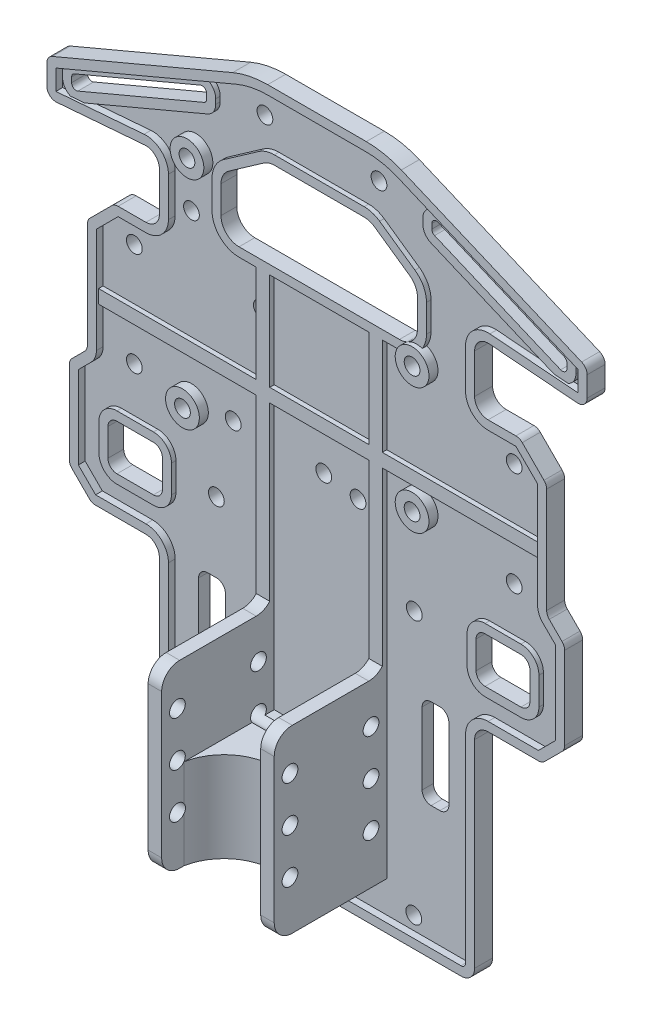
from build123d import *

# Parameters (mm, degrees)
BOSS_EXTRUDE1_DEPTH     = 2.5
CUT_EXTRUDE6_DEPTH      = 101.031245119
CUT_EXTRUDE8_DEPTH      = 101.031245119
CUT_EXTRUDE8_DEPTH_BACK = 101.031245119
SKETCH17_R              = 1.75
BOSS_EXTRUDE2_DEPTH     = 1.5
SKETCH20_R              = 1.75
CUT_EXTRUDE9_DEPTH      = 101.031245119
BOSS_EXTRUDE3_DEPTH     = 25
CUT_EXTRUDE10_DEPTH     = 33
SKETCH23_R              = 1.75
CUT_EXTRUDE11_DEPTH     = 113.393282717
LPATTERN1_COUNT         = 3
LPATTERN1_PITCH         = 10
FILLET1_R               = 4
BOSS_EXTRUDE4_START     = 1
BOSS_EXTRUDE4_DEPTH     = 1
BOSS_EXTRUDE5_START     = 2
SKETCH25_R              = 3.75
SKETCH25_R_2            = 1.75
BOSS_EXTRUDE5_DEPTH     = 2
BOSS_EXTRUDE6_DEPTH     = 1


with BuildPart() as part:
    # Sketch1 → Boss-Extrude1 (new body)
    with BuildSketch(Plane.XY):
        with BuildLine():
            Line((-35, 41.750415311), (-35, 33))
            ThreePointArc((-35, 33), (-35.878679656, 30.878679656), (-38, 30))
            Line((-38, 30), (-44.171572875, 30))
            ThreePointArc((-44.171572875, 30), (-44.93693974, 29.847759065), (-45.585786438, 29.414213562))
            Line((-45.585786438, 29.414213562), (-50.414213562, 24.585786438))
            ThreePointArc((-50.414213562, 24.585786438), (-50.847759065, 23.93693974), (-51, 23.171572875))
            Line((-51, 23.171572875), (-51, -0.171572875))
            ThreePointArc((-51, -0.171572875), (-51.152240935, -0.93693974), (-51.585786438, -1.585786438))
            Line((-51.585786438, -1.585786438), (-54.414213562, -4.414213562))
            ThreePointArc((-54.414213562, -4.414213562), (-54.847759065, -5.06306026), (-55, -5.828427125))
            Line((-55, -5.828427125), (-55, -24.171572875))
            ThreePointArc((-55, -24.171572875), (-54.847759065, -24.93693974), (-54.414213562, -25.585786438))
            Line((-54.414213562, -25.585786438), (-50.585786438, -29.414213562))
            ThreePointArc((-50.585786438, -29.414213562), (-49.93693974, -29.847759065), (-49.171572875, -30))
            Line((-49.171572875, -30), (-38, -30))
            ThreePointArc((-38, -30), (-35.878679656, -30.878679656), (-35, -33))
            Line((-35, -33), (-35, -77))
            ThreePointArc((-35, -77), (-34.121320344, -79.121320344), (-32, -80))
            Line((-32, -80), (32, -80))
            ThreePointArc((32, -80), (34.121320344, -79.121320344), (35, -77))
            Line((35, -77), (35, -33))
            ThreePointArc((35, -33), (35.878679656, -30.878679656), (38, -30))
            Line((38, -30), (49.171572875, -30))
            ThreePointArc((49.171572875, -30), (49.93693974, -29.847759065), (50.585786438, -29.414213562))
            Line((50.585786438, -29.414213562), (54.414213562, -25.585786438))
            ThreePointArc((54.414213562, -25.585786438), (54.847759065, -24.93693974), (55, -24.171572875))
            Line((55, -24.171572875), (55, -5.828427125))
            ThreePointArc((55, -5.828427125), (54.847759065, -5.06306026), (54.414213562, -4.414213562))
            Line((54.414213562, -4.414213562), (51.585786438, -1.585786438))
            ThreePointArc((51.585786438, -1.585786438), (51.152240935, -0.93693974), (51, -0.171572875))
            Line((51, -0.171572875), (51, 23.171572875))
            ThreePointArc((51, 23.171572875), (50.847759065, 23.93693974), (50.414213562, 24.585786438))
            Line((50.414213562, 24.585786438), (45.585786438, 29.414213562))
            ThreePointArc((45.585786438, 29.414213562), (44.93693974, 29.847759065), (44.171572875, 30))
            Line((44.171572875, 30), (38, 30))
            ThreePointArc((38, 30), (35.878679656, 30.878679656), (35, 33))
            Line((35, 33), (35, 41.750415311))
            ThreePointArc((35, 41.750415311), (35.965019288, 43.954696033), (38.239235667, 44.740861147))
            Line((38.239235667, 44.740861147), (57.840509555, 43.172759236))
            ThreePointArc((57.840509555, 43.172759236), (59.356653808, 43.696869311), (60, 45.166389793))
            Line((60, 45.166389793), (60, 49.673480046))
            ThreePointArc((60, 49.673480046), (59.666716555, 50.77894643), (58.777944074, 51.515979169))
            Line((58.777944074, 51.515979169), (18.730283933, 68.424991228))
            ThreePointArc((18.730283933, 68.424991228), (14.91948121, 69.602293546), (10.950843192, 70))
            Line((10.950843192, 70), (-10.950843192, 70))
            ThreePointArc((-10.950843192, 70), (-14.91948121, 69.602293546), (-18.730283933, 68.424991228))
            Line((-18.730283933, 68.424991228), (-58.777944074, 51.515979169))
            ThreePointArc((-58.777944074, 51.515979169), (-59.666716555, 50.77894643), (-60, 49.673480046))
            Line((-60, 49.673480046), (-60, 45.166389793))
            ThreePointArc((-60, 45.166389793), (-59.356653808, 43.696869311), (-57.840509555, 43.172759236))
            Line((-57.840509555, 43.172759236), (-38.239235667, 44.740861147))
            ThreePointArc((-38.239235667, 44.740861147), (-35.965019288, 43.954696033), (-35, 41.750415311))
        make_face()
    extrude(amount=BOSS_EXTRUDE1_DEPTH)

    # Sketch14 → Cut-Extrude6 (cut, through all)
    with BuildSketch(Plane.XY.offset(2.5)):
        with BuildLine():
            Line((-53.611027963, 47.184672776), (-25.611027963, 59.006894998))
            ThreePointArc((-25.611027963, 59.006894998), (-25.166641723, 59.375411367), (-25, 59.928144559))
            Line((-25, 59.928144559), (-25, 61.013626758))
            ThreePointArc((-25, 61.013626758), (-25.447266808, 61.846985036), (-26.388972037, 61.93487632))
            Line((-26.388972037, 61.93487632), (-54.388972037, 50.112654098))
            ThreePointArc((-54.388972037, 50.112654098), (-54.833358277, 49.744137728), (-55, 49.191404536))
            Line((-55, 49.191404536), (-55, 48.105922337))
            ThreePointArc((-55, 48.105922337), (-54.552733192, 47.27256406), (-53.611027963, 47.184672776))
        make_face()
        with BuildLine():
            Line((55, 49.191404536), (55, 48.105922337))
            ThreePointArc((55, 48.105922337), (54.552733192, 47.27256406), (53.611027963, 47.184672776))
            Line((53.611027963, 47.184672776), (25.611027963, 59.006894998))
            ThreePointArc((25.611027963, 59.006894998), (25.166641723, 59.375411367), (25, 59.928144559))
            Line((25, 59.928144559), (25, 61.013626758))
            ThreePointArc((25, 61.013626758), (25.447266808, 61.846985036), (26.388972037, 61.93487632))
            Line((26.388972037, 61.93487632), (54.388972037, 50.112654098))
            ThreePointArc((54.388972037, 50.112654098), (54.833358277, 49.744137728), (55, 49.191404536))
        make_face()
    extrude(amount=-CUT_EXTRUDE6_DEPTH, mode=Mode.SUBTRACT)

    # Sketch17 → Cut-Extrude8 (cut, two sides: drawn at the far end of the back side and taken through both)
    with BuildSketch(Plane.XY.offset(2.5).offset(-CUT_EXTRUDE8_DEPTH_BACK)):
        with Locations((21.620159532, 32.389035853)):
            Circle(SKETCH17_R)
        with Locations((21.620159532, 4.389035853)):
            Circle(SKETCH17_R)
        with Locations((-29.379840468, -1.210964147)):
            Circle(SKETCH17_R)
        with Locations((-28.379840468, 47.389035853)):
            Circle(SKETCH17_R)
        with Locations((-29.379840468, 35.789035853)):
            Circle(SKETCH17_R)
        with Locations((7.620159532, -1.210964147)):
            Circle(SKETCH17_R)
    extrude(amount=CUT_EXTRUDE8_DEPTH + CUT_EXTRUDE8_DEPTH_BACK, mode=Mode.SUBTRACT)

    # Sketch19 → Boss-Extrude2 (add)
    with BuildSketch(Plane.XY.offset(2.5)):
        with BuildLine():
            Line((60, 45.166389793), (60, 49.673480046))
            ThreePointArc((60, 49.673480046), (59.666716555, 50.77894643), (58.777944074, 51.515979169))
            Line((58.777944074, 51.515979169), (18.730283933, 68.424991228))
            ThreePointArc((18.730283933, 68.424991228), (14.91948121, 69.602293546), (10.950843192, 70))
            Line((10.950843192, 70), (-10.950843192, 70))
            ThreePointArc((-10.950843192, 70), (-14.91948121, 69.602293546), (-18.730283933, 68.424991228))
            Line((-18.730283933, 68.424991228), (-58.777944074, 51.515979169))
            ThreePointArc((-58.777944074, 51.515979169), (-59.666716555, 50.77894643), (-60, 49.673480046))
            Line((-60, 49.673480046), (-60, 45.166389793))
            ThreePointArc((-60, 45.166389793), (-59.356653808, 43.696869311), (-57.840509555, 43.172759236))
            Line((-57.840509555, 43.172759236), (-38.239235667, 44.740861147))
            ThreePointArc((-38.239235667, 44.740861147), (-35.965019288, 43.954696033), (-35, 41.750415311))
            Line((-35, 41.750415311), (-35, 33))
            ThreePointArc((-35, 33), (-35.878679656, 30.878679656), (-38, 30))
            Line((-38, 30), (-44.171572875, 30))
            ThreePointArc((-44.171572875, 30), (-44.93693974, 29.847759065), (-45.585786438, 29.414213562))
            Line((-45.585786438, 29.414213562), (-50.414213562, 24.585786438))
            ThreePointArc((-50.414213562, 24.585786438), (-50.847759065, 23.93693974), (-51, 23.171572875))
            Line((-51, 23.171572875), (-51, -0.171572875))
            ThreePointArc((-51, -0.171572875), (-51.152240935, -0.93693974), (-51.585786438, -1.585786438))
            Line((-51.585786438, -1.585786438), (-54.414213562, -4.414213562))
            ThreePointArc((-54.414213562, -4.414213562), (-54.847759065, -5.06306026), (-55, -5.828427125))
            Line((-55, -5.828427125), (-55, -24.171572875))
            ThreePointArc((-55, -24.171572875), (-54.847759065, -24.93693974), (-54.414213562, -25.585786438))
            Line((-54.414213562, -25.585786438), (-50.585786438, -29.414213562))
            ThreePointArc((-50.585786438, -29.414213562), (-49.93693974, -29.847759065), (-49.171572875, -30))
            Line((-49.171572875, -30), (-38, -30))
            ThreePointArc((-38, -30), (-35.878679656, -30.878679656), (-35, -33))
            Line((-35, -33), (-35, -77))
            ThreePointArc((-35, -77), (-34.121320344, -79.121320344), (-32, -80))
            Line((-32, -80), (32, -80))
            ThreePointArc((32, -80), (34.121320344, -79.121320344), (35, -77))
            Line((35, -77), (35, -33))
            ThreePointArc((35, -33), (35.878679656, -30.878679656), (38, -30))
            Line((38, -30), (49.171572875, -30))
            ThreePointArc((49.171572875, -30), (49.93693974, -29.847759065), (50.585786438, -29.414213562))
            Line((50.585786438, -29.414213562), (54.414213562, -25.585786438))
            ThreePointArc((54.414213562, -25.585786438), (54.847759065, -24.93693974), (55, -24.171572875))
            Line((55, -24.171572875), (55, -5.828427125))
            ThreePointArc((55, -5.828427125), (54.847759065, -5.06306026), (54.414213562, -4.414213562))
            Line((54.414213562, -4.414213562), (51.585786438, -1.585786438))
            ThreePointArc((51.585786438, -1.585786438), (51.152240935, -0.93693974), (51, -0.171572875))
            Line((51, -0.171572875), (51, 23.171572875))
            ThreePointArc((51, 23.171572875), (50.847759065, 23.93693974), (50.414213562, 24.585786438))
            Line((50.414213562, 24.585786438), (45.585786438, 29.414213562))
            ThreePointArc((45.585786438, 29.414213562), (44.93693974, 29.847759065), (44.171572875, 30))
            Line((44.171572875, 30), (38, 30))
            ThreePointArc((38, 30), (35.878679656, 30.878679656), (35, 33))
            Line((35, 33), (35, 41.750415311))
            ThreePointArc((35, 41.750415311), (35.965019288, 43.954696033), (38.239235667, 44.740861147))
            Line((38.239235667, 44.740861147), (57.840509555, 43.172759236))
            ThreePointArc((57.840509555, 43.172759236), (59.356653808, 43.696869311), (60, 45.166389793))
        make_face()
        with BuildLine():
            Line((58, 45.166389793), (58, 49.673480046))
            Line((58, 49.673480046), (17.952339859, 66.582492105))
            ThreePointArc((17.952339859, 66.582492105), (14.522617409, 67.642064192), (10.950843192, 68))
            Line((10.950843192, 68), (-10.950843192, 68))
            ThreePointArc((-10.950843192, 68), (-14.522617409, 67.642064192), (-17.952339859, 66.582492105))
            Line((-17.952339859, 66.582492105), (-58, 49.673480046))
            Line((-58, 49.673480046), (-58, 45.166389793))
            Line((-58, 45.166389793), (-38.398726111, 46.734491704))
            ThreePointArc((-38.398726111, 46.734491704), (-34.608365479, 45.424216514), (-33, 41.750415311))
            Line((-33, 41.750415311), (-33, 33))
            ThreePointArc((-33, 33), (-34.464466094, 29.464466094), (-38, 28))
            Line((-38, 28), (-44.171572875, 28))
            Line((-44.171572875, 28), (-49, 23.171572875))
            Line((-49, 23.171572875), (-49, -0.171572875))
            ThreePointArc((-49, -0.171572875), (-49.30448187, -1.702306605), (-50.171572875, -3))
            Line((-50.171572875, -3), (-53, -5.828427125))
            Line((-53, -5.828427125), (-53, -24.171572875))
            Line((-53, -24.171572875), (-49.171572875, -28))
            Line((-49.171572875, -28), (-38, -28))
            ThreePointArc((-38, -28), (-34.464466094, -29.464466094), (-33, -33))
            Line((-33, -33), (-33, -77))
            ThreePointArc((-33, -77), (-32.707106781, -77.707106781), (-32, -78))
            Line((-32, -78), (32, -78))
            ThreePointArc((32, -78), (32.707106781, -77.707106781), (33, -77))
            Line((33, -77), (33, -33))
            ThreePointArc((33, -33), (34.464466094, -29.464466094), (38, -28))
            Line((38, -28), (49.171572875, -28))
            Line((49.171572875, -28), (53, -24.171572875))
            Line((53, -24.171572875), (53, -5.828427125))
            Line((53, -5.828427125), (50.171572875, -3))
            ThreePointArc((50.171572875, -3), (49.30448187, -1.702306605), (49, -0.171572875))
            Line((49, -0.171572875), (49, 23.171572875))
            Line((49, 23.171572875), (44.171572875, 28))
            Line((44.171572875, 28), (38, 28))
            ThreePointArc((38, 28), (34.464466094, 29.464466094), (33, 33))
            Line((33, 33), (33, 41.750415311))
            ThreePointArc((33, 41.750415311), (34.608365479, 45.424216514), (38.398726111, 46.734491704))
            Line((38.398726111, 46.734491704), (58, 45.166389793))
        make_face(mode=Mode.SUBTRACT)
    extrude(amount=BOSS_EXTRUDE2_DEPTH)

    # Sketch20 → Cut-Extrude9 (cut, through all)
    with BuildSketch(Plane.XY.offset(2.5)):
        with Locations((-42.063788719, 22.958679518)):
            Circle(SKETCH20_R)
        with Locations((42.297587904, 22.958679518)):
            Circle(SKETCH20_R)
        with Locations((42.297587904, -0.128383611)):
            Circle(SKETCH20_R)
        with Locations((-42.063788719, 0)):
            Circle(SKETCH20_R)
        with Locations((-23.845073149, -16.476520205)):
            Circle(SKETCH20_R)
        with Locations((20.10871853, -16.476520205)):
            Circle(SKETCH20_R)
        with Locations((-20.10871853, 0)):
            Circle(SKETCH20_R)
        with Locations((-13.860133221, 24.581013684)):
            Circle(SKETCH20_R)
        with Locations((-13.060600457, 62.35325386)):
            Circle(SKETCH20_R)
        with Locations((12.268263331, 62.35325386)):
            Circle(SKETCH20_R)
        Circle(SKETCH20_R)
        with Locations((-25, -75)):
            Circle(SKETCH20_R)
        with Locations((-10, -75)):
            Circle(SKETCH20_R)
        with Locations((5, -75)):
            Circle(SKETCH20_R)
        with Locations((20, -75)):
            Circle(SKETCH20_R)
        with BuildLine():
            Line((-20.10871853, 48.534341211), (-12.268263331, 54.019136509))
            ThreePointArc((-12.268263331, 54.019136509), (-11.177384694, 54.556649905), (-9.975402579, 54.741517011))
            Line((-9.975402579, 54.741517011), (9.975402579, 54.741517011))
            ThreePointArc((9.975402579, 54.741517011), (11.177384694, 54.556649905), (12.268263331, 54.019136509))
            Line((12.268263331, 54.019136509), (20.10871853, 48.534341211))
            ThreePointArc((20.10871853, 48.534341211), (21.363493822, 47.104498349), (21.815857777, 45.256721714))
            Line((21.815857777, 45.256721714), (21.815857777, 39.127215003))
            ThreePointArc((21.815857777, 39.127215003), (20.644284902, 36.298787879), (17.815857777, 35.127215003))
            Line((17.815857777, 35.127215003), (-17.815857777, 35.127215003))
            ThreePointArc((-17.815857777, 35.127215003), (-20.644284902, 36.298787879), (-21.815857777, 39.127215003))
            Line((-21.815857777, 39.127215003), (-21.815857777, 45.256721714))
            ThreePointArc((-21.815857777, 45.256721714), (-21.363493822, 47.104498349), (-20.10871853, 48.534341211))
        make_face()
        with BuildLine():
            Line((23.845073149, -32.047731886), (25.785548208, -32.047731886))
            ThreePointArc((25.785548208, -32.047731886), (27.199761771, -32.633518324), (27.785548208, -34.047731886))
            Line((27.785548208, -34.047731886), (27.785548208, -50.012136511))
            ThreePointArc((27.785548208, -50.012136511), (27.199761771, -51.426350074), (25.785548208, -52.012136511))
            Line((25.785548208, -52.012136511), (23.845073149, -52.012136511))
            ThreePointArc((23.845073149, -52.012136511), (22.430859586, -51.426350074), (21.845073149, -50.012136511))
            Line((21.845073149, -50.012136511), (21.845073149, -34.047731886))
            ThreePointArc((21.845073149, -34.047731886), (22.430859586, -32.633518324), (23.845073149, -32.047731886))
        make_face()
        with BuildLine():
            Line((-25.794328973, -32.047731886), (-23.845073149, -32.047731886))
            ThreePointArc((-23.845073149, -32.047731886), (-22.430859586, -32.633518324), (-21.845073149, -34.047731886))
            Line((-21.845073149, -34.047731886), (-21.845073149, -50.012136511))
            ThreePointArc((-21.845073149, -50.012136511), (-22.430859586, -51.426350074), (-23.845073149, -52.012136511))
            Line((-23.845073149, -52.012136511), (-25.794328973, -52.012136511))
            ThreePointArc((-25.794328973, -52.012136511), (-27.208542535, -51.426350074), (-27.794328973, -50.012136511))
            Line((-27.794328973, -50.012136511), (-27.794328973, -34.047731886))
            ThreePointArc((-27.794328973, -34.047731886), (-27.208542535, -32.633518324), (-25.794328973, -32.047731886))
        make_face()
        with BuildLine():
            Line((44.790205594, -11.983902515), (36.825682441, -11.983902515))
            ThreePointArc((36.825682441, -11.983902515), (35.411468878, -12.569688952), (34.825682441, -13.983902515))
            Line((34.825682441, -13.983902515), (34.825682441, -20.092292317))
            ThreePointArc((34.825682441, -20.092292317), (35.411468878, -21.50650588), (36.825682441, -22.092292317))
            Line((36.825682441, -22.092292317), (44.790205594, -22.092292317))
            ThreePointArc((44.790205594, -22.092292317), (46.204419156, -21.50650588), (46.790205594, -20.092292317))
            Line((46.790205594, -20.092292317), (46.790205594, -13.983902515))
            ThreePointArc((46.790205594, -13.983902515), (46.204419156, -12.569688952), (44.790205594, -11.983902515))
        make_face()
        with BuildLine():
            Line((-36.825682441, -11.983902515), (-44.930791216, -11.983902515))
            ThreePointArc((-44.930791216, -11.983902515), (-46.345004779, -12.569688952), (-46.930791216, -13.983902515))
            Line((-46.930791216, -13.983902515), (-46.930791216, -20.092292317))
            ThreePointArc((-46.930791216, -20.092292317), (-46.345004779, -21.50650588), (-44.930791216, -22.092292317))
            Line((-44.930791216, -22.092292317), (-36.825682441, -22.092292317))
            ThreePointArc((-36.825682441, -22.092292317), (-35.411468878, -21.50650588), (-34.825682441, -20.092292317))
            Line((-34.825682441, -20.092292317), (-34.825682441, -13.983902515))
            ThreePointArc((-34.825682441, -13.983902515), (-35.411468878, -12.569688952), (-36.825682441, -11.983902515))
        make_face()
    extrude(amount=-CUT_EXTRUDE9_DEPTH, mode=Mode.SUBTRACT)

    # Sketch21 → Boss-Extrude3 (add)
    with BuildSketch(Plane.XY.offset(2.5)):
        Polygon((-14, -71), (-11, -71), (11, -71), (14, -71), (14, -31), (11, -31), (11, -51), (-11, -51), (-11, -31), (-14, -31), align=None)
    extrude(amount=BOSS_EXTRUDE3_DEPTH)

    # Sketch22 → Cut-Extrude10 (cut)
    with BuildSketch(Plane.XZ.offset(71)):
        with BuildLine():
            Line((-11, 22.5), (-11, 27.5))
            Line((-11, 27.5), (11, 27.5))
            Line((11, 27.5), (11, 22.5))
            ThreePointArc((11, 22.5), (0, 13.424273727), (-11, 22.5))
        make_face()
    extrude(amount=-CUT_EXTRUDE10_DEPTH, mode=Mode.SUBTRACT)

    # Sketch23 → Cut-Extrude11 (cut, symmetric)
    with BuildSketch(Plane.ZY.offset(14)):
        with Locations((6, -40)):
            Circle(SKETCH23_R)
        with Locations((24, -40)):
            Circle(SKETCH23_R)
    cut_extrude11 = extrude(amount=CUT_EXTRUDE11_DEPTH, both=True, mode=Mode.SUBTRACT)

    # LPattern1: Cut-Extrude11 ×3
    with Locations(*[(0, -i * LPATTERN1_PITCH, 0) for i in range(1, LPATTERN1_COUNT)]):
        add(cut_extrude11, mode=Mode.SUBTRACT)

    # Fillet1
    fillet1_edges = [part.edges().sort_by_distance(p)[0] for p in [
        (12.5, -31, 2.5),
        (-12.5, -31, 2.5),
        (-12.5, -71, 27.5),
        (12.5, -31, 27.5),
        (-12.5, -31, 27.5),
        (12.5, -71, 27.5),
    ]]
    fillet(fillet1_edges, radius=FILLET1_R)

    # Sketch24 → Boss-Extrude4 (add)
    # profile 1 of 5: a face of its own
    with BuildSketch(Plane.XY.offset(2.5).offset(BOSS_EXTRUDE4_START)):
        with BuildLine():
            Line((48.790205594, -20.092292317), (48.790205594, -13.983902515))
            ThreePointArc((48.790205594, -13.983902515), (47.618632719, -11.15547539), (44.790205594, -9.983902515))
            Line((44.790205594, -9.983902515), (36.825682441, -9.983902515))
            ThreePointArc((36.825682441, -9.983902515), (33.997255316, -11.15547539), (32.825682441, -13.983902515))
            Line((32.825682441, -13.983902515), (32.825682441, -20.092292317))
            ThreePointArc((32.825682441, -20.092292317), (33.997255316, -22.920719442), (36.825682441, -24.092292317))
            Line((36.825682441, -24.092292317), (44.790205594, -24.092292317))
            ThreePointArc((44.790205594, -24.092292317), (47.618632719, -22.920719442), (48.790205594, -20.092292317))
        make_face()
        with BuildLine():
            Line((46.790205594, -20.092292317), (46.790205594, -13.983902515))
            ThreePointArc((46.790205594, -13.983902515), (46.204419156, -12.569688952), (44.790205594, -11.983902515))
            Line((44.790205594, -11.983902515), (36.825682441, -11.983902515))
            ThreePointArc((36.825682441, -11.983902515), (35.411468878, -12.569688952), (34.825682441, -13.983902515))
            Line((34.825682441, -13.983902515), (34.825682441, -20.092292317))
            ThreePointArc((34.825682441, -20.092292317), (35.411468878, -21.50650588), (36.825682441, -22.092292317))
            Line((36.825682441, -22.092292317), (44.790205594, -22.092292317))
            ThreePointArc((44.790205594, -22.092292317), (46.204419156, -21.50650588), (46.790205594, -20.092292317))
        make_face(mode=Mode.SUBTRACT)
    # profile 2 of 5: a face of its own
    with BuildSketch(Plane.XY.offset(2.5).offset(BOSS_EXTRUDE4_START)):
        with BuildLine():
            Line((-17.815857777, 33.127215003), (17.815857777, 33.127215003))
            ThreePointArc((17.815857777, 33.127215003), (22.058498465, 34.884574316), (23.815857777, 39.127215003))
            Line((23.815857777, 39.127215003), (23.815857777, 45.256721714))
            ThreePointArc((23.815857777, 45.256721714), (23.137311844, 48.028386667), (21.255148906, 50.17315096))
            Line((21.255148906, 50.17315096), (13.414693708, 55.657946258))
            ThreePointArc((13.414693708, 55.657946258), (11.778375752, 56.464216352), (9.975402579, 56.741517011))
            Line((9.975402579, 56.741517011), (-9.975402579, 56.741517011))
            ThreePointArc((-9.975402579, 56.741517011), (-11.778375752, 56.464216352), (-13.414693708, 55.657946258))
            Line((-13.414693708, 55.657946258), (-21.255148906, 50.17315096))
            ThreePointArc((-21.255148906, 50.17315096), (-23.137311844, 48.028386667), (-23.815857777, 45.256721714))
            Line((-23.815857777, 45.256721714), (-23.815857777, 39.127215003))
            ThreePointArc((-23.815857777, 39.127215003), (-22.058498465, 34.884574316), (-17.815857777, 33.127215003))
        make_face()
        with BuildLine():
            Line((-21.815857777, 45.256721714), (-21.815857777, 39.127215003))
            ThreePointArc((-21.815857777, 39.127215003), (-20.644284902, 36.298787879), (-17.815857777, 35.127215003))
            Line((-17.815857777, 35.127215003), (17.815857777, 35.127215003))
            ThreePointArc((17.815857777, 35.127215003), (20.644284902, 36.298787879), (21.815857777, 39.127215003))
            Line((21.815857777, 39.127215003), (21.815857777, 45.256721714))
            ThreePointArc((21.815857777, 45.256721714), (21.363493822, 47.104498349), (20.10871853, 48.534341211))
            Line((20.10871853, 48.534341211), (12.268263331, 54.019136509))
            ThreePointArc((12.268263331, 54.019136509), (11.177384694, 54.556649905), (9.975402579, 54.741517011))
            Line((9.975402579, 54.741517011), (-9.975402579, 54.741517011))
            ThreePointArc((-9.975402579, 54.741517011), (-11.177384694, 54.556649905), (-12.268263331, 54.019136509))
            Line((-12.268263331, 54.019136509), (-20.10871853, 48.534341211))
            ThreePointArc((-20.10871853, 48.534341211), (-21.363493822, 47.104498349), (-21.815857777, 45.256721714))
        make_face(mode=Mode.SUBTRACT)
    # profile 3 of 5: a face of its own
    with BuildSketch(Plane.XY.offset(2.5).offset(BOSS_EXTRUDE4_START)):
        with BuildLine():
            Line((-32.825682441, -20.092292317), (-32.825682441, -13.983902515))
            ThreePointArc((-32.825682441, -13.983902515), (-33.997255316, -11.15547539), (-36.825682441, -9.983902515))
            Line((-36.825682441, -9.983902515), (-44.930791216, -9.983902515))
            ThreePointArc((-44.930791216, -9.983902515), (-47.759218341, -11.15547539), (-48.930791216, -13.983902515))
            Line((-48.930791216, -13.983902515), (-48.930791216, -20.092292317))
            ThreePointArc((-48.930791216, -20.092292317), (-47.759218341, -22.920719442), (-44.930791216, -24.092292317))
            Line((-44.930791216, -24.092292317), (-36.825682441, -24.092292317))
            ThreePointArc((-36.825682441, -24.092292317), (-33.997255316, -22.920719442), (-32.825682441, -20.092292317))
        make_face()
        with BuildLine():
            Line((-34.825682441, -20.092292317), (-34.825682441, -13.983902515))
            ThreePointArc((-34.825682441, -13.983902515), (-35.411468878, -12.569688952), (-36.825682441, -11.983902515))
            Line((-36.825682441, -11.983902515), (-44.930791216, -11.983902515))
            ThreePointArc((-44.930791216, -11.983902515), (-46.345004779, -12.569688952), (-46.930791216, -13.983902515))
            Line((-46.930791216, -13.983902515), (-46.930791216, -20.092292317))
            ThreePointArc((-46.930791216, -20.092292317), (-46.345004779, -21.50650588), (-44.930791216, -22.092292317))
            Line((-44.930791216, -22.092292317), (-36.825682441, -22.092292317))
            ThreePointArc((-36.825682441, -22.092292317), (-35.411468878, -21.50650588), (-34.825682441, -20.092292317))
        make_face(mode=Mode.SUBTRACT)
    # profile 4 of 5: a face of its own
    with BuildSketch(Plane.XY.offset(2.5).offset(BOSS_EXTRUDE4_START)):
        with BuildLine():
            Line((-23, 59.928144559), (-23, 61.013626758))
            ThreePointArc((-23, 61.013626758), (-24.341800424, 63.513701591), (-27.166916111, 63.777375443))
            Line((-27.166916111, 63.777375443), (-55.166916111, 51.95515322))
            ThreePointArc((-55.166916111, 51.95515322), (-56.500074832, 50.849604112), (-57, 49.191404536))
            Line((-57, 49.191404536), (-57, 48.105922337))
            ThreePointArc((-57, 48.105922337), (-55.658199576, 45.605847505), (-52.833083889, 45.342173653))
            Line((-52.833083889, 45.342173653), (-24.833083889, 57.164395875))
            ThreePointArc((-24.833083889, 57.164395875), (-23.499925168, 58.269944983), (-23, 59.928144559))
        make_face()
        with BuildLine():
            Line((-25, 59.928144559), (-25, 61.013626758))
            ThreePointArc((-25, 61.013626758), (-25.447266808, 61.846985036), (-26.388972037, 61.93487632))
            Line((-26.388972037, 61.93487632), (-54.388972037, 50.112654098))
            ThreePointArc((-54.388972037, 50.112654098), (-54.833358277, 49.744137728), (-55, 49.191404536))
            Line((-55, 49.191404536), (-55, 48.105922337))
            ThreePointArc((-55, 48.105922337), (-54.552733192, 47.27256406), (-53.611027963, 47.184672776))
            Line((-53.611027963, 47.184672776), (-25.611027963, 59.006894998))
            ThreePointArc((-25.611027963, 59.006894998), (-25.166641723, 59.375411367), (-25, 59.928144559))
        make_face(mode=Mode.SUBTRACT)
    # profile 5 of 5: a face of its own
    with BuildSketch(Plane.XY.offset(2.5).offset(BOSS_EXTRUDE4_START)):
        with BuildLine():
            Line((55.166916111, 51.95515322), (27.166916111, 63.777375443))
            ThreePointArc((27.166916111, 63.777375443), (24.341800424, 63.513701591), (23, 61.013626758))
            Line((23, 61.013626758), (23, 59.928144559))
            ThreePointArc((23, 59.928144559), (23.499925168, 58.269944983), (24.833083889, 57.164395875))
            Line((24.833083889, 57.164395875), (52.833083889, 45.342173653))
            ThreePointArc((52.833083889, 45.342173653), (55.658199576, 45.605847505), (57, 48.105922337))
            Line((57, 48.105922337), (57, 49.191404536))
            ThreePointArc((57, 49.191404536), (56.500074832, 50.849604112), (55.166916111, 51.95515322))
        make_face()
        with BuildLine():
            Line((54.388972037, 50.112654098), (26.388972037, 61.93487632))
            ThreePointArc((26.388972037, 61.93487632), (25.447266808, 61.846985036), (25, 61.013626758))
            Line((25, 61.013626758), (25, 59.928144559))
            ThreePointArc((25, 59.928144559), (25.166641723, 59.375411367), (25.611027963, 59.006894998))
            Line((25.611027963, 59.006894998), (53.611027963, 47.184672776))
            ThreePointArc((53.611027963, 47.184672776), (54.552733192, 47.27256406), (55, 48.105922337))
            Line((55, 48.105922337), (55, 49.191404536))
            ThreePointArc((55, 49.191404536), (54.833358277, 49.744137728), (54.388972037, 50.112654098))
        make_face(mode=Mode.SUBTRACT)
    extrude(amount=-BOSS_EXTRUDE4_DEPTH)

    # Sketch25 → Boss-Extrude5 (add)
    # profile 1 of 4: a face of its own
    with BuildSketch(Plane.XY.offset(2.5).offset(BOSS_EXTRUDE5_START)):
        with Locations(Location((21.620159532, 32.389035853, 0), (0, 0, 168.626051316))):
            Circle(SKETCH25_R)
        with Locations((21.620159532, 32.389035853)):
            Circle(SKETCH25_R_2, mode=Mode.SUBTRACT)
    # profile 2 of 4: a face of its own
    with BuildSketch(Plane.XY.offset(2.5).offset(BOSS_EXTRUDE5_START)):
        with Locations(Location((-28.379840468, 47.389035853, 0), (0, 0, 180))):
            Circle(SKETCH25_R)
        with Locations((-28.379840468, 47.389035853)):
            Circle(SKETCH25_R_2, mode=Mode.SUBTRACT)
    # profile 3 of 4: a face of its own
    with BuildSketch(Plane.XY.offset(2.5).offset(BOSS_EXTRUDE5_START)):
        with Locations(Location((-29.379840468, -1.210964147, 0), (0, 0, 180))):
            Circle(SKETCH25_R)
        with Locations((-29.379840468, -1.210964147)):
            Circle(SKETCH25_R_2, mode=Mode.SUBTRACT)
    # profile 4 of 4: a face of its own
    with BuildSketch(Plane.XY.offset(2.5).offset(BOSS_EXTRUDE5_START)):
        with Locations(Location((21.620159532, 4.389035853, 0), (0, 0, 180))):
            Circle(SKETCH25_R)
        with Locations((21.620159532, 4.389035853)):
            Circle(SKETCH25_R_2, mode=Mode.SUBTRACT)
    extrude(amount=-BOSS_EXTRUDE5_DEPTH)

    # Sketch26 → Boss-Extrude6 (add)
    with BuildSketch(Plane.XY.offset(2.5)):
        Polygon((-14, -35), (-11, -35), (-11, 8.503404189), (11, 8.503404189), (11, -35), (14, -35), (14, 8.503404189), (49, 8.503404189), (49, 11.503404189), (14, 11.503404189), (14, 33.127215003), (11, 33.127215003), (11, 11.503404189), (-11, 11.503404189), (-11, 33.127215003), (-14, 33.127215003), (-14, 11.503404189), (-49, 11.503404189), (-49, 8.503404189), (-14, 8.503404189), align=None)
    extrude(amount=BOSS_EXTRUDE6_DEPTH)


solid = part.part
